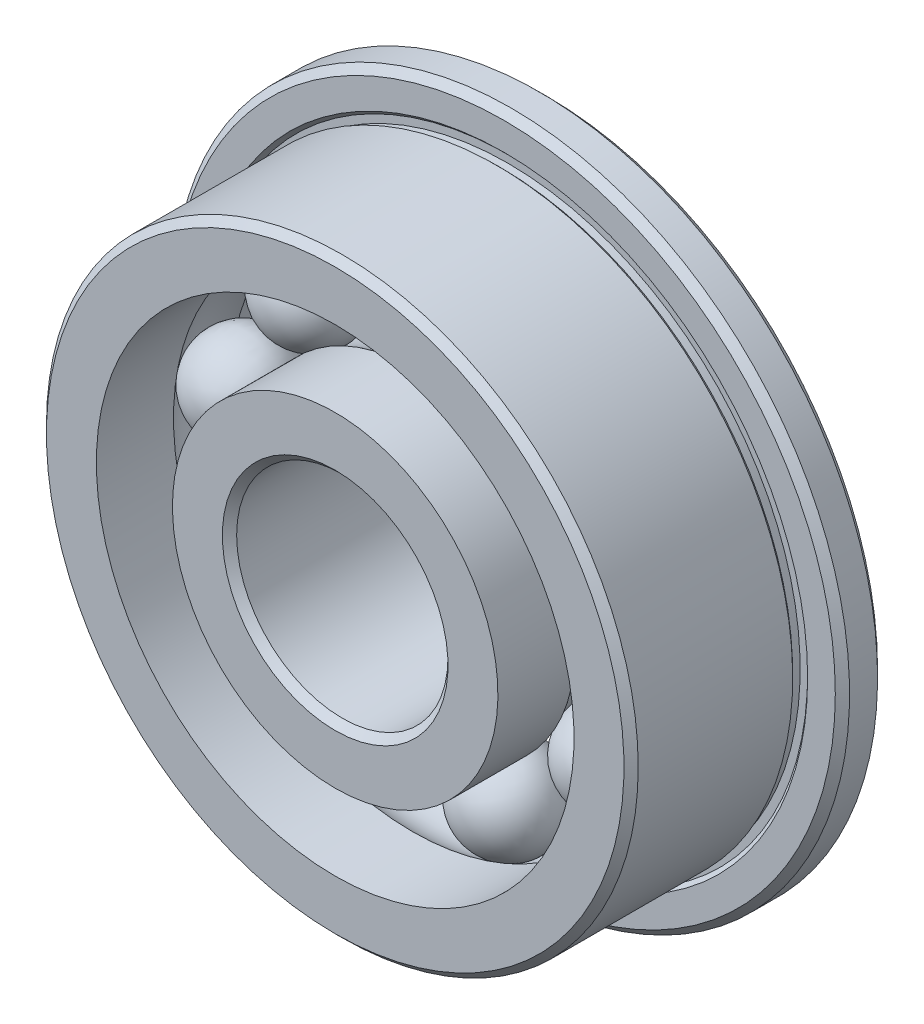
from build123d import *

# Parameters (mm, degrees)
FILLET1_SIZE      = 0.16875
FILLET2_SIZE      = 0.16875
CIRPATTERN3_COUNT = 9


with BuildPart() as part:
    # Sketch2 → Revolve1 (revolve)
    with BuildSketch(Plane(origin=(0, 0, 0), x_dir=(0, 0, -1), z_dir=(1, 0, 0)), mode=Mode.PRIVATE) as revolve1_sk:
        with BuildLine():
            Line((2.5, 8), (1.5, 8))
            Line((1.5, 8), (1.5, 7.176776695))
            Line((1.5, 7.176776695), (1.588388348, 7.088388348))
            Line((1.588388348, 7.088388348), (1.588388348, 6.911611652))
            Line((1.588388348, 6.911611652), (1.411611652, 6.911611652))
            Line((1.411611652, 6.911611652), (1.323223305, 7))
            Line((1.323223305, 7), (-2.5, 7))
            Line((-2.5, 7), (-2.5, 5.65))
            Line((-2.5, 5.65), (-0.675, 5.65))
            ThreePointArc((-0.675, 5.65), (0, 5.875), (0.675, 5.65))
            Line((0.675, 5.65), (2.5, 5.65))
            Line((2.5, 5.65), (2.5, 8))
        make_face()
        with BuildLine():
            Line((2.5, 2.5), (-2.5, 2.5))
            Line((-2.5, 2.5), (-2.5, 3.85))
            Line((-2.5, 3.85), (-0.675, 3.85))
            ThreePointArc((-0.675, 3.85), (0, 3.625), (0.675, 3.85))
            Line((0.675, 3.85), (2.5, 3.85))
            Line((2.5, 3.85), (2.5, 2.5))
        make_face()
    revolve(revolve1_sk.sketch.rotate(Axis((0, 0, 0), (0, 0, -1)), 180), axis=Axis((0, 0, 0), (0, 0, -1)))

    # Fillet1
    fillet1_edges = [part.edges().sort_by_distance(p)[0] for p in [
        (0, 7, 2.5),
        (0, 8, -2.5),
        (0, 8, -1.5),
    ]]
    chamfer(fillet1_edges, length=FILLET1_SIZE)

    # Fillet2
    fillet2_edges = [part.edges().sort_by_distance(p)[0] for p in [
        (0, 2.5, -2.5),
        (0, 2.5, 2.5),
    ]]
    chamfer(fillet2_edges, length=FILLET2_SIZE)


with BuildPart() as body_2:
    # Sketch7 → Revolve3 (revolve)
    with BuildSketch(Plane.XY):
        with BuildLine():
            Line((0, 5.875), (0, 3.625))
            ThreePointArc((0, 3.625), (-1.125, 4.75), (0, 5.875))
        make_face()
    revolve(axis=Axis((0, 5.875, 0), (0, -1, 0)))


with BuildPart() as cirpattern3_1:
    # CirPattern3: pattern copy
    add(body_2.part.rotate(Axis((0, 0, 0), (0, 0, 1)), 1 * 360 / CIRPATTERN3_COUNT))


with BuildPart() as cirpattern3_2:
    # CirPattern3: pattern copy
    add(body_2.part.rotate(Axis((0, 0, 0), (0, 0, 1)), 2 * 360 / CIRPATTERN3_COUNT))


with BuildPart() as cirpattern3_3:
    # CirPattern3: pattern copy
    add(body_2.part.rotate(Axis((0, 0, 0), (0, 0, 1)), 3 * 360 / CIRPATTERN3_COUNT))


with BuildPart() as cirpattern3_4:
    # CirPattern3: pattern copy
    add(body_2.part.rotate(Axis((0, 0, 0), (0, 0, 1)), 4 * 360 / CIRPATTERN3_COUNT))


with BuildPart() as cirpattern3_5:
    # CirPattern3: pattern copy
    add(body_2.part.rotate(Axis((0, 0, 0), (0, 0, 1)), 5 * 360 / CIRPATTERN3_COUNT))


with BuildPart() as cirpattern3_6:
    # CirPattern3: pattern copy
    add(body_2.part.rotate(Axis((0, 0, 0), (0, 0, 1)), 6 * 360 / CIRPATTERN3_COUNT))


with BuildPart() as cirpattern3_7:
    # CirPattern3: pattern copy
    add(body_2.part.rotate(Axis((0, 0, 0), (0, 0, 1)), 7 * 360 / CIRPATTERN3_COUNT))


with BuildPart() as cirpattern3_8:
    # CirPattern3: pattern copy
    add(body_2.part.rotate(Axis((0, 0, 0), (0, 0, 1)), 8 * 360 / CIRPATTERN3_COUNT))


solid = Compound([part.part, body_2.part, cirpattern3_1.part, cirpattern3_2.part, cirpattern3_3.part, cirpattern3_4.part, cirpattern3_5.part, cirpattern3_6.part, cirpattern3_7.part, cirpattern3_8.part])
